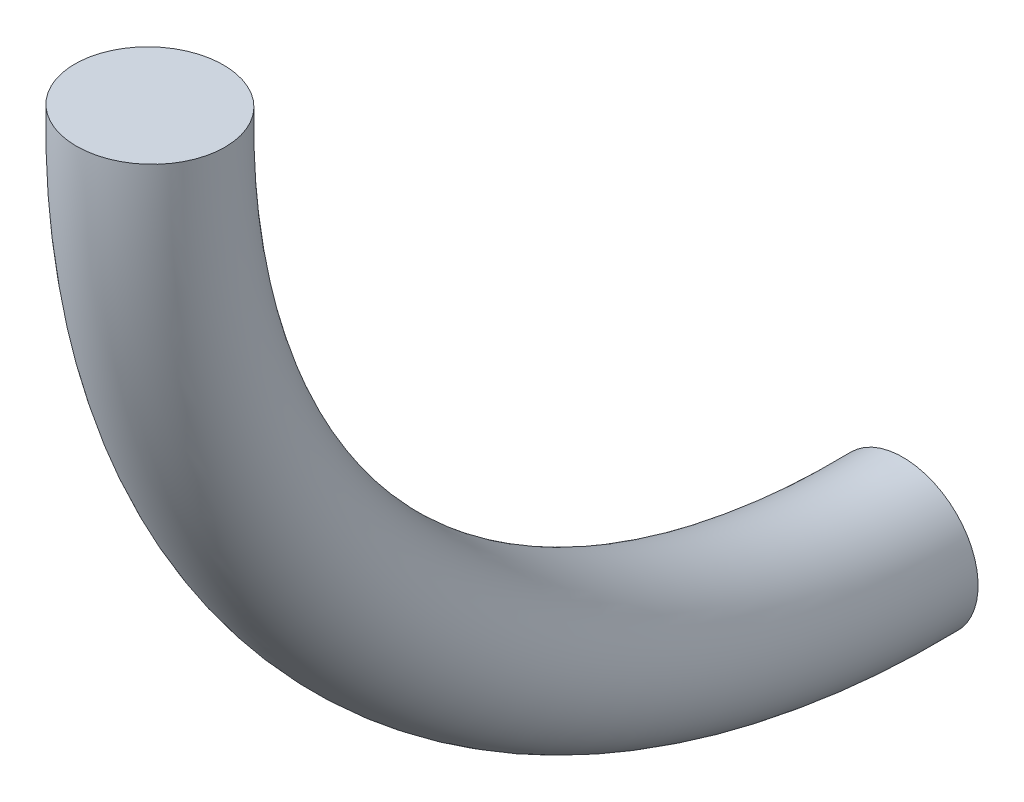
from build123d import *

# Parameters (mm, degrees)
SWEEP1_PROFILE_R = 39


with BuildPart() as part:
    # Sweep1: sweep along a path in Sketch3
    with BuildLine(Plane(origin=(0, 0, 0), x_dir=(0, 0, -1), z_dir=(1, 0, 0))) as sweep1_path:
        ThreePointArc((0, 0), (114.617880258, -285.382119742), (400, -400))
    # Sweep1 profile (on start of the path) → Sweep1 (sweep)
    with BuildSketch(Plane(origin=(0, 0, 0), x_dir=(0, -0.021575818423397435, -0.9997672149352371), z_dir=(0, -0.9997672149352371, 0.021575818423397435))):
        Circle(SWEEP1_PROFILE_R)
    sweep(path=sweep1_path.line)


solid = part.part
